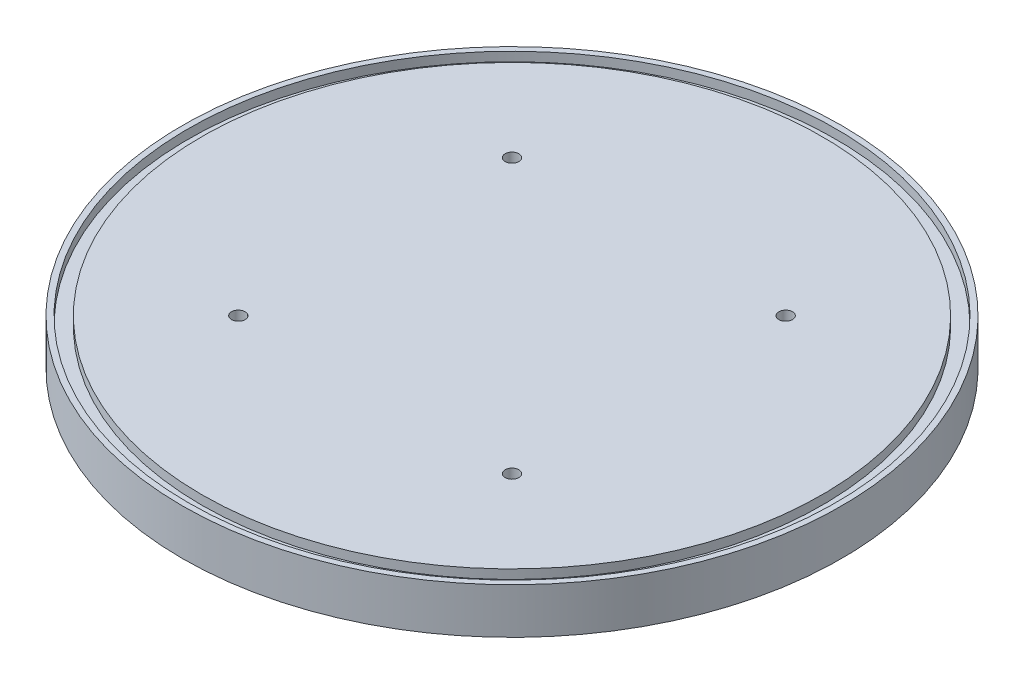
from build123d import *

# Parameters (mm, degrees)
SKETCH_1_R          = 72.25
EXTRUDE_7_DEPTH     = 10
F_3_0MM_1_D         = 3
F_3_0MM_1_DEPTH     = 6
F_3_0MM_1_TIP       = 0.901290929
CUT_EXTRUDE_START   = 10
SKETCH_1_11_R       = 71
SKETCH_1_11_R_2     = 68
CUT_EXTRUDE_1_DEPTH = 2


with BuildPart() as part:
    # 草圖1 → 填料-伸長7 (new body)
    with BuildSketch(Plane(origin=(0, 0, 0), x_dir=(1, 0, 0), z_dir=(0, 1, 0))):
        with Locations(Location((0, 0, 0), (0, 0, 270))):
            Circle(SKETCH_1_R)
    extrude(amount=EXTRUDE_7_DEPTH)

    # Ø3.0mm 定位孔1
    with Locations(Plane(origin=(0, 10, 0), x_dir=(1, 0, 0), z_dir=(0, 1, 0))):
        with Locations((-30, 30), (-30, -30), (30, -30), (30, 30)):
            Hole(F_3_0MM_1_D / 2, depth=F_3_0MM_1_DEPTH)
            with Locations((0, 0, -(F_3_0MM_1_DEPTH + F_3_0MM_1_TIP / 2))):  # 118° drill point
                Cone(0, F_3_0MM_1_D / 2, F_3_0MM_1_TIP, mode=Mode.SUBTRACT)

    # 草圖1<11> → 除料-伸長1 (cut)
    with BuildSketch(Plane(origin=(0, 0, 0), x_dir=(1, 0, 0), z_dir=(0, 1, 0)).offset(CUT_EXTRUDE_START)):
        with Locations(Location((0, 0, 0), (0, 0, 270))):
            Circle(SKETCH_1_11_R)
        with Locations(Location((0, 0, 0), (0, 0, 270))):
            Circle(SKETCH_1_11_R_2, mode=Mode.SUBTRACT)
    extrude(amount=-CUT_EXTRUDE_1_DEPTH, mode=Mode.SUBTRACT)


solid = part.part
